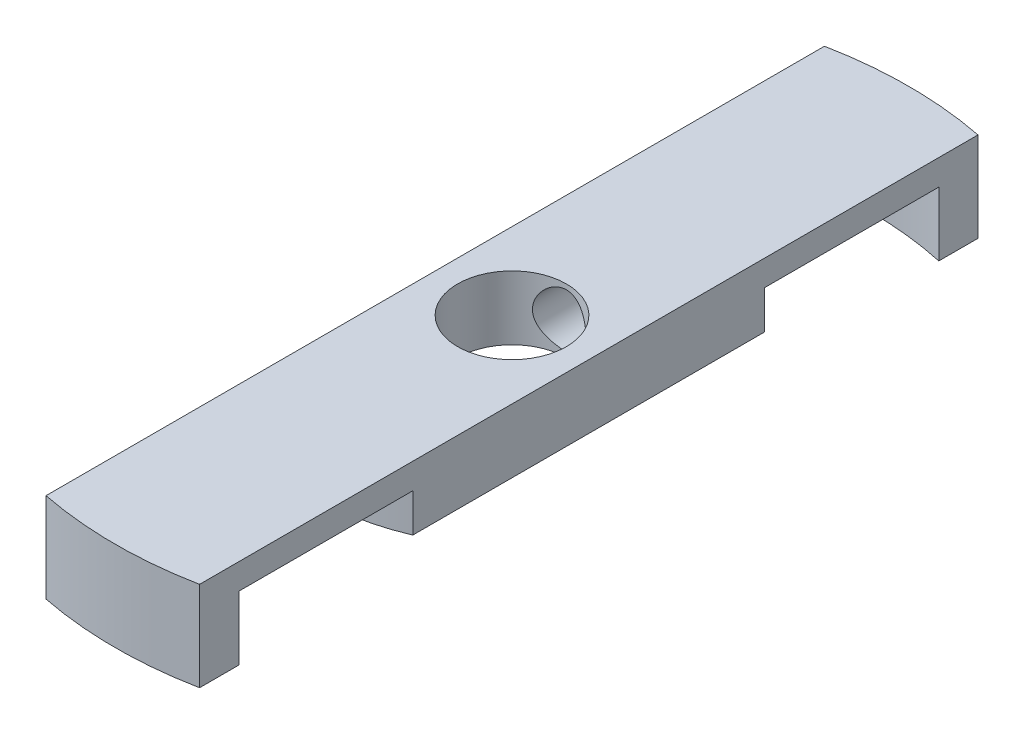
from build123d import *

# Parameters (mm, degrees)
CORTE_EXTRUS_O1_DEPTH      = 45.395945761
CORTE_EXTRUS_O1_DEPTH_BACK = 45.395945761
ESBO_O2_W                  = 96.741183006
ESBO_O2_H                  = 102.357875962
ESBO_O2_W_2                = 12
ESBO_O2_H_2                = 76.270119436
ESBO_O3_R                  = 2.1
CORTE_EXTRUS_O4_DEPTH      = 13


with BuildPart() as part:
    # Esboço1 → Revolução1 (revolve)
    with BuildSketch(Plane.XY, mode=Mode.PRIVATE) as revolu_o1_sk:
        Polygon((4.25, 5), (4.25, 0), (15, 0), (15, 3), (28, 3), (28, -2), (31, -2), (31, 5), align=None)
    revolve(revolu_o1_sk.sketch.rotate(Axis((0, 0, 0), (0, 1, 0)), 90), axis=Axis((0, 0, 0), (0, 1, 0)))

    # Esboço2 → Corte-extrusão1 (cut, two sides: drawn at the far end of the back side and taken through both)
    with BuildSketch(Plane(origin=(0, 5, 0), x_dir=(1, 0, 0), z_dir=(0, 1, 0)).offset(-CORTE_EXTRUS_O1_DEPTH_BACK)):
        Rectangle(ESBO_O2_W, ESBO_O2_H)
        Rectangle(ESBO_O2_W_2, ESBO_O2_H_2, mode=Mode.SUBTRACT)
    extrude(amount=CORTE_EXTRUS_O1_DEPTH + CORTE_EXTRUS_O1_DEPTH_BACK, mode=Mode.SUBTRACT)

    # Esboço3 → Corte-extrusão4 (cut, symmetric)
    with BuildSketch(Plane.XY):
        with Locations((0, 2.5)):
            Circle(ESBO_O3_R)
    extrude(amount=CORTE_EXTRUS_O4_DEPTH, both=True, mode=Mode.SUBTRACT)


solid = part.part
